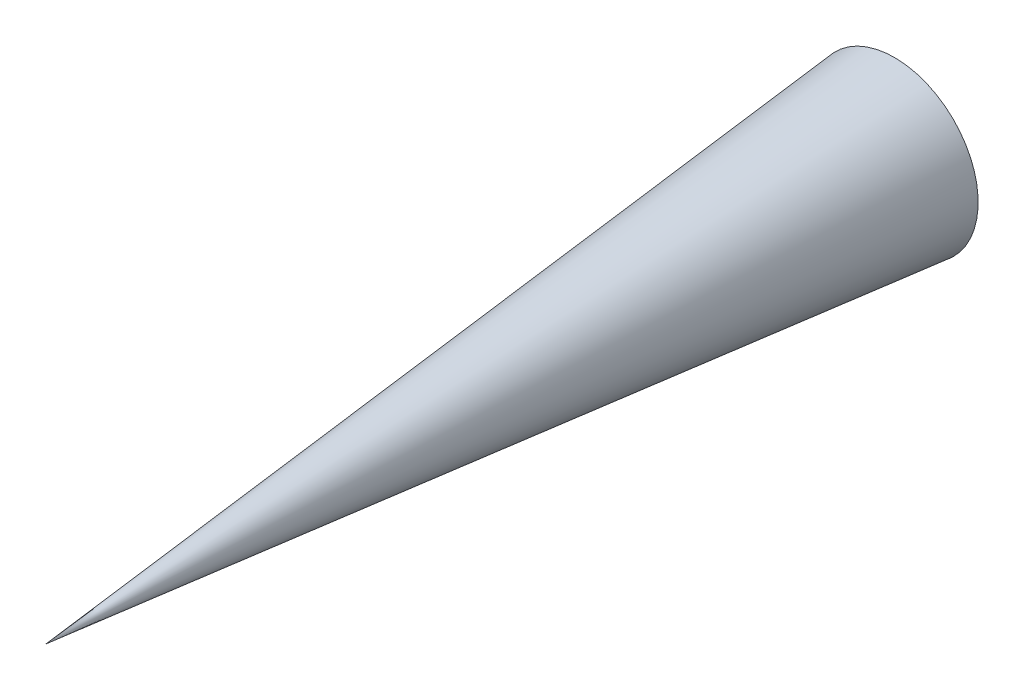
from build123d import *


with BuildPart() as part:
    # Sketch2 → Revolve1 (revolve)
    with BuildSketch(Plane(origin=(0, 0, 0), x_dir=(0, 0, -1), z_dir=(1, 0, 0)), mode=Mode.PRIVATE) as revolve1_sk:
        with BuildLine():
            Line((0, 0), (0, 50.8))
            add(Edge.make_bspline(
                [(-515.43466696, 0), (-507.288117879, 0.802904267), (-491.124652277, 2.395936527), (-452.264197851, 6.225929369), (-422.796328148, 9.13021167), (-381.313054253, 13.218703285), (-351.44335661, 16.162588781), (-319.014018258, 19.358746304), (-291.829419681, 22.0379949), (-263.966154628, 24.78413123), (-237.038137035, 27.438091822), (-209.980153707, 30.104861524), (-186.020888084, 32.466229068), (-165.005703706, 34.537435051), (-146.041588122, 36.406492632), (-129.683525237, 38.018703932), (-112.79458612, 39.683237116), (-97.44062705, 41.196486361), (-80.427726051, 42.873236929), (-64.286234605, 44.46410347), (-43.499116183, 46.512831822), (-28.924939451, 47.949227597), (-10.367718231, 49.778182649), (-3.317599173, 50.473025412), (0, 50.8)],
                knots=[0.083402836, 0.083402836, 0.083402836, 0.083402836, 0.083402836, 0.146623644, 0.209844452, 0.269060323, 0.327990126, 0.382128307, 0.423250439, 0.467376275, 0.51064391, 0.558274066, 0.600254399, 0.640875914, 0.666550428, 0.694084377, 0.722691078, 0.74774578, 0.773897072, 0.796710916, 0.827510797, 0.861600449, 0.891685162, 0.917431193, 0.917431193, 0.917431193, 0.917431193, 0.917431193], degree=4))
            Line((-515.43466696, 0), (0, 0))
        make_face()
    revolve(revolve1_sk.sketch.rotate(Axis((0, 0, 0), (0, 0, 1)), 90), axis=Axis((0, 0, 0), (0, 0, 1)))


solid = part.part
